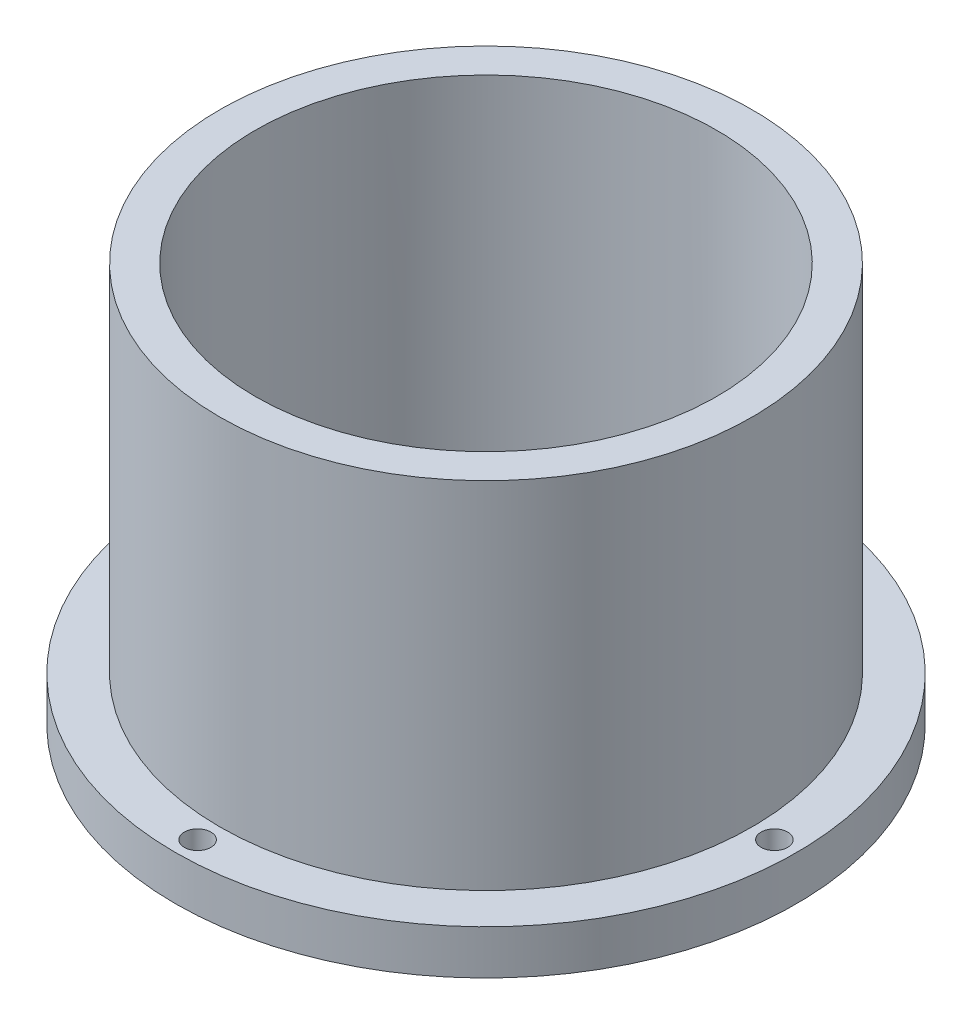
from build123d import *

# Parameters (mm, degrees)
SKETCH1_R           = 35
BOSS_EXTRUDE1_DEPTH = 5
SKETCH2_R           = 30
BOSS_EXTRUDE2_DEPTH = 40
SKETCH3_R           = 26
CUT_EXTRUDE2_DEPTH  = 60
SKETCH4_R           = 1.5
CUT_EXTRUDE3_DEPTH  = 60
BOSS_EXTRUDE3_START = -5
SKETCH5_R           = 26
BOSS_EXTRUDE3_DEPTH = 5


with BuildPart() as part:
    # Sketch1 → Boss-Extrude1 (new body)
    with BuildSketch(Plane(origin=(0, 0, 0), x_dir=(1, 0, 0), z_dir=(0, 1, 0))):
        with Locations(Location((0, 0, 0), (0, 0, 270))):
            Circle(SKETCH1_R)
    extrude(amount=BOSS_EXTRUDE1_DEPTH)

    # Sketch2 → Boss-Extrude2 (add)
    with BuildSketch(Plane(origin=(0, 5, 0), x_dir=(1, 0, 0), z_dir=(0, 1, 0))):
        with Locations(Location((0, 0, 0), (0, 0, 270))):
            Circle(SKETCH2_R)
    extrude(amount=BOSS_EXTRUDE2_DEPTH)

    # Sketch3 → Cut-Extrude2 (cut)
    with BuildSketch(Plane(origin=(0, 45, 0), x_dir=(1, 0, 0), z_dir=(0, 1, 0))):
        with Locations(Location((0, 0, 0), (0, 0, 270))):
            Circle(SKETCH3_R)
    extrude(amount=-CUT_EXTRUDE2_DEPTH, mode=Mode.SUBTRACT)

    # Sketch4 → Cut-Extrude3 (cut)
    with BuildSketch(Plane.XZ):
        with Locations(Location((0, 32.5, 0), (0, 0, 270))):
            Circle(SKETCH4_R)
        with Locations(Location((32.5, 0, 0), (0, 0, 270))):
            Circle(SKETCH4_R)
        with Locations(Location((0, -32.5, 0), (0, 0, 270))):
            Circle(SKETCH4_R)
        with Locations(Location((-32.5, 0, 0), (0, 0, 270))):
            Circle(SKETCH4_R)
    extrude(amount=-CUT_EXTRUDE3_DEPTH, mode=Mode.SUBTRACT)

    # Sketch5 → Boss-Extrude3 (add)
    with BuildSketch(Plane.XZ.offset(BOSS_EXTRUDE3_START)):
        with Locations(Location((0, 0, 0), (0, 0, 90))):
            Circle(SKETCH5_R)
    extrude(amount=BOSS_EXTRUDE3_DEPTH)


solid = part.part
